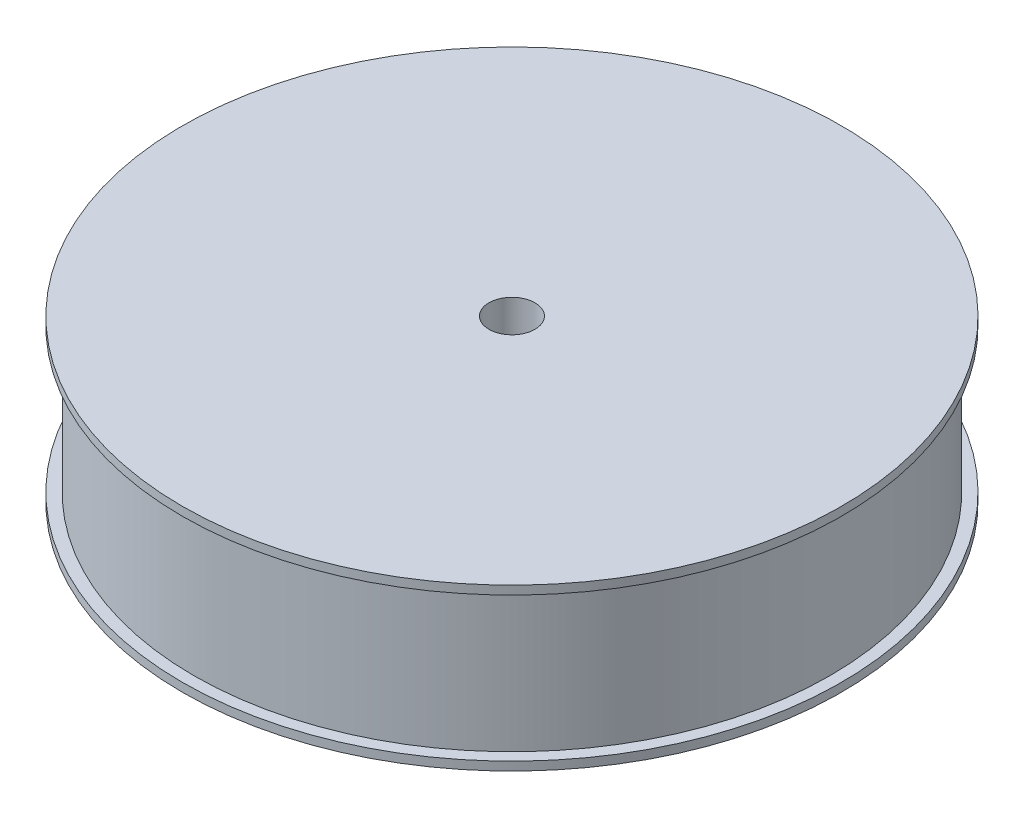
from build123d import *


with BuildPart() as part:
    # Sketch1 → Revolve1 (revolve)
    with BuildSketch(Plane(origin=(0, 0, 0), x_dir=(0, 0, -1), z_dir=(1, 0, 0)), mode=Mode.PRIVATE) as revolve1_sk:
        Polygon((55.295, -12.5), (55.295, 12.5), (57.295, 12.5), (57.295, 14), (4, 14), (4, -14), (57.295, -14), (57.295, -12.5), align=None)
    revolve(revolve1_sk.sketch.rotate(Axis((0, 10.31552251, 0), (0, -1, 0)), 180), axis=Axis((0, 10.31552251, 0), (0, -1, 0)))


solid = part.part
